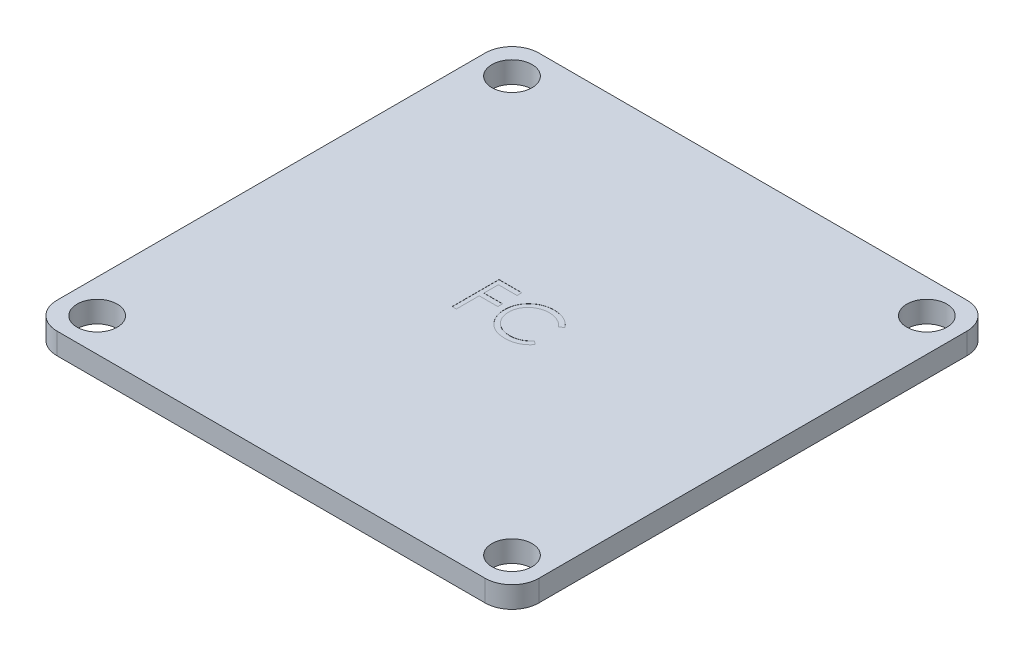
from build123d import *

# Parameters (mm, degrees)
SKETCH1_W           = 36
SKETCH1_H           = 36
SKETCH1_R           = 1.5
BOSS_EXTRUDE1_DEPTH = 1.6
FILLET1_R           = 2
CUT_EXTRUDE1_DEPTH  = 0.01


with BuildPart() as part:
    # Sketch1 → Boss-Extrude1 (new body)
    with BuildSketch(Plane(origin=(0, 0, 0), x_dir=(1, 0, 0), z_dir=(0, 1, 0))):
        Rectangle(SKETCH1_W, SKETCH1_H)
        with Locations(Location((-15.5, 15.5, 0), (0, 0, 270))):
            Circle(SKETCH1_R, mode=Mode.SUBTRACT)
        with Locations(Location((15.5, 15.5, 0), (0, 0, 270))):
            Circle(SKETCH1_R, mode=Mode.SUBTRACT)
        with Locations(Location((-15.5, -15.5, 0), (0, 0, 90))):
            Circle(SKETCH1_R, mode=Mode.SUBTRACT)
        with Locations(Location((15.5, -15.5, 0), (0, 0, 90))):
            Circle(SKETCH1_R, mode=Mode.SUBTRACT)
    extrude(amount=BOSS_EXTRUDE1_DEPTH)

    # Fillet1
    fillet1_edges = [part.edges().sort_by_distance(p)[0] for p in [
        (18, 0.8, 18),
        (-18, 0.8, 18),
        (-18, 0.8, -18),
        (18, 0.8, -18),
    ]]
    fillet(fillet1_edges, radius=FILLET1_R)

    # Sketch2 → Cut-Extrude1 (cut)
    with BuildSketch(Plane(origin=(0, 1.6, 0), x_dir=(1, 0, 0), z_dir=(0, 1, 0))):
        Polygon((-2.822286409, 1.851413804), (-1.117158204, 1.851413804), (-1.117158204, 1.492439445), (-2.508183845, 1.492439445), (-2.508183845, 0.415516368), (-1.117158204, 0.415516368), (-1.117158204, 0.056542009), (-2.508183845, 0.056542009), (-2.508183845, -1.648586196), (-2.822286409, -1.648586196), align=None)
        with BuildLine():
            Line((2.741816155, 1.209186239), (2.466976411, 0.998849701))
            add(Edge.make_bspline(
                [(2.466976411, 0.998849701), (2.447370523, 1.022215671), (2.408423076, 1.068632587), (2.345763874, 1.133812131), (2.280462231, 1.194877392), (2.212543109, 1.252119272), (2.14078399, 1.303536038), (2.066923191, 1.351807141), (1.989725146, 1.395074879), (1.882973411, 1.447537865), (1.743325563, 1.50228402), (1.567530724, 1.548187251), (1.384019626, 1.577408427), (1.258822026, 1.580573268), (1.195141475, 1.582183034)],
                knots=[0, 0, 0, 0, 0.757959112, 1.505699292, 2.245454638, 2.979532153, 3.711538275, 4.438200793, 5.171680507, 5.909471876, 7.393775596, 8.890124382, 10.418191784, 12, 12, 12, 12], degree=3))
            add(Edge.make_bspline(
                [(1.195141475, 1.582183034), (1.160058176, 1.581779072), (1.090217183, 1.580974896), (0.98656871, 1.570365771), (0.884855659, 1.555454561), (0.785144193, 1.533329238), (0.687561234, 1.505356618), (0.591468832, 1.471931205), (0.498258232, 1.430576365), (0.406639994, 1.384868105), (0.318860783, 1.33324066), (0.235805735, 1.276927308), (0.157777767, 1.216558212), (0.084715155, 1.151907105), (0.016543207, 1.083265145), (-0.046244104, 1.009900803), (-0.103429514, 0.93204863), (-0.156146539, 0.850735222), (-0.203359273, 0.76619743), (-0.242889152, 0.67812236), (-0.277894274, 0.588018257), (-0.305593517, 0.494867096), (-0.327518034, 0.39932433), (-0.342645697, 0.301133542), (-0.353134168, 0.200499863), (-0.353934345, 0.13229055), (-0.354337691, 0.097908195)],
                knots=[0, 0, 0, 0, 1.054917814, 2.100044995, 3.131103042, 4.146048494, 5.169673617, 6.183595914, 7.203665975, 8.234915748, 9.262203917, 10.264457458, 11.251630812, 12.227803204, 13.197192746, 14.159520551, 15.12972552, 16.100847026, 17.073214652, 18.039054194, 19.002613845, 19.979014051, 20.95965708, 21.949030935, 22.966165397, 24, 24, 24, 24], degree=3))
            add(Edge.make_bspline(
                [(-0.354337691, 0.097908195), (-0.353075872, 0.046176875), (-0.350598458, -0.05539071), (-0.328550124, -0.204161321), (-0.295045033, -0.346681994), (-0.244829456, -0.482061837), (-0.182910405, -0.611970195), (-0.104669794, -0.734209048), (-0.014053256, -0.850625613), (0.090221163, -0.958468561), (0.204626979, -1.056982286), (0.327374891, -1.143732867), (0.458159179, -1.21604775), (0.595535809, -1.276223696), (0.740561923, -1.322480424), (0.892976725, -1.355044547), (1.05244872, -1.376286728), (1.16141812, -1.378320416), (1.216876251, -1.379355427)],
                knots=[0, 0, 0, 0, 1.029171465, 2.020641659, 2.987623507, 3.938342917, 4.889210282, 5.84687017, 6.821220943, 7.821438502, 8.827599549, 9.822697543, 10.807740252, 11.797342354, 12.80366471, 13.83203677, 14.896651826, 16, 16, 16, 16], degree=3))
            add(Edge.make_bspline(
                [(1.216876251, -1.379355427), (1.27797894, -1.377666647), (1.398243649, -1.374342725), (1.574611675, -1.346183476), (1.743447441, -1.300525558), (1.904760027, -1.236627636), (2.058094674, -1.153562348), (2.203691334, -1.05286447), (2.341672904, -0.933576138), (2.424644187, -0.842493009), (2.466976411, -0.796022094)],
                knots=[0, 0, 0, 0, 1.028121516, 2.023589091, 2.998037872, 3.967518031, 4.937445131, 5.927275754, 6.942489185, 8, 8, 8, 8], degree=3))
            Line((2.466976411, -0.796022094), (2.741816155, -1.004255267))
            add(Edge.make_bspline(
                [(2.741816155, -1.004255267), (2.719698045, -1.032793719), (2.67556777, -1.089733925), (2.604109753, -1.170005635), (2.528832455, -1.24550967), (2.449176745, -1.315637292), (2.366058954, -1.381791757), (2.277986641, -1.442093588), (2.186117609, -1.497384473), (2.09076313, -1.548011397), (1.992024517, -1.592928644), (1.890020082, -1.631382412), (1.785189507, -1.664507302), (1.677527998, -1.691759238), (1.566812241, -1.713030322), (1.453441767, -1.727249997), (1.337171892, -1.736991911), (1.258730471, -1.737879827), (1.218979616, -1.738329786)],
                knots=[0, 0, 0, 0, 0.986787822, 1.968848986, 2.935600012, 3.899624008, 4.868462664, 5.837806735, 6.815139263, 7.798259679, 8.787526145, 9.778297419, 10.776456485, 11.791383307, 12.812564526, 13.85620153, 14.913611965, 16, 16, 16, 16], degree=3))
            add(Edge.make_bspline(
                [(1.218979616, -1.738329786), (1.181335949, -1.738067794), (1.106900259, -1.737549736), (0.997001508, -1.729157568), (0.890011927, -1.717707831), (0.786237301, -1.7004677), (0.685111326, -1.68012336), (0.587550741, -1.652852104), (0.492595531, -1.622302937), (0.40062719, -1.58639795), (0.311567491, -1.545881768), (0.225703679, -1.500090209), (0.143075247, -1.449408344), (0.062869826, -1.394953334), (-0.013727758, -1.334976032), (-0.087381283, -1.270309397), (-0.158503759, -1.201171387), (-0.202506444, -1.151316533), (-0.224630159, -1.126250459)],
                knots=[0, 0, 0, 0, 1.114604814, 2.203992996, 3.262667896, 4.300477797, 5.318619304, 6.316056647, 7.298880507, 8.271930387, 9.238335007, 10.195173496, 11.151986948, 12.108099108, 13.064862484, 14.031167946, 15.010108607, 16, 16, 16, 16], degree=3))
            add(Edge.make_bspline(
                [(-0.224630159, -1.126250459), (-0.260065803, -1.08270927), (-0.33050928, -0.99615256), (-0.420634963, -0.855866579), (-0.497782518, -0.70939837), (-0.560158439, -0.555978441), (-0.608921172, -0.395951054), (-0.642702367, -0.229235539), (-0.664653972, -0.055987597), (-0.667164261, 0.061849192), (-0.668440255, 0.121746336)],
                knots=[0, 0, 0, 0, 0.994628077, 1.977248131, 2.950237994, 3.925870899, 4.908910175, 5.911660606, 6.938484602, 8, 8, 8, 8], degree=3))
            add(Edge.make_bspline(
                [(-0.668440255, 0.121746336), (-0.666885062, 0.184701789), (-0.663825316, 0.308562714), (-0.63782952, 0.490336667), (-0.596010724, 0.664488066), (-0.536613835, 0.83069181), (-0.461308484, 0.989822091), (-0.36828187, 1.140663296), (-0.258614728, 1.284180095), (-0.13316716, 1.418194847), (0.004400175, 1.540734199), (0.151718989, 1.648540403), (0.308500936, 1.738257919), (0.473018788, 1.813254081), (0.646504469, 1.870898544), (0.828587838, 1.911251731), (1.018926753, 1.936368847), (1.148789179, 1.939544055), (1.214772886, 1.941157393)],
                knots=[0, 0, 0, 0, 1.032925535, 2.032216505, 3.007276963, 3.968222605, 4.92396291, 5.891752235, 6.871517503, 7.883894988, 8.900124299, 9.891468569, 10.874487609, 11.85992873, 12.854644235, 13.869047385, 14.917252991, 16, 16, 16, 16], degree=3))
            add(Edge.make_bspline(
                [(1.214772886, 1.941157393), (1.254987358, 1.940675255), (1.334587855, 1.939720911), (1.452340507, 1.930414769), (1.566982834, 1.914901163), (1.678593816, 1.893785093), (1.787716432, 1.867577772), (1.893516673, 1.833437473), (1.99661536, 1.794400942), (2.096362268, 1.749442476), (2.192278819, 1.698975735), (2.284335137, 1.643560111), (2.371799996, 1.583264305), (2.455288844, 1.51860113), (2.533405055, 1.448202571), (2.608366534, 1.374004975), (2.677627612, 1.293871151), (2.720380807, 1.237466217), (2.741816155, 1.209186239)],
                knots=[0, 0, 0, 0, 1.096760587, 2.17092713, 3.219439832, 4.250915756, 5.268269357, 6.278326846, 7.281116186, 8.274029601, 9.260640565, 10.235837813, 11.203064059, 12.156899882, 13.114053108, 14.069676657, 15.032185724, 16, 16, 16, 16], degree=3))
        make_face()
    extrude(amount=-CUT_EXTRUDE1_DEPTH, mode=Mode.SUBTRACT)


solid = part.part
